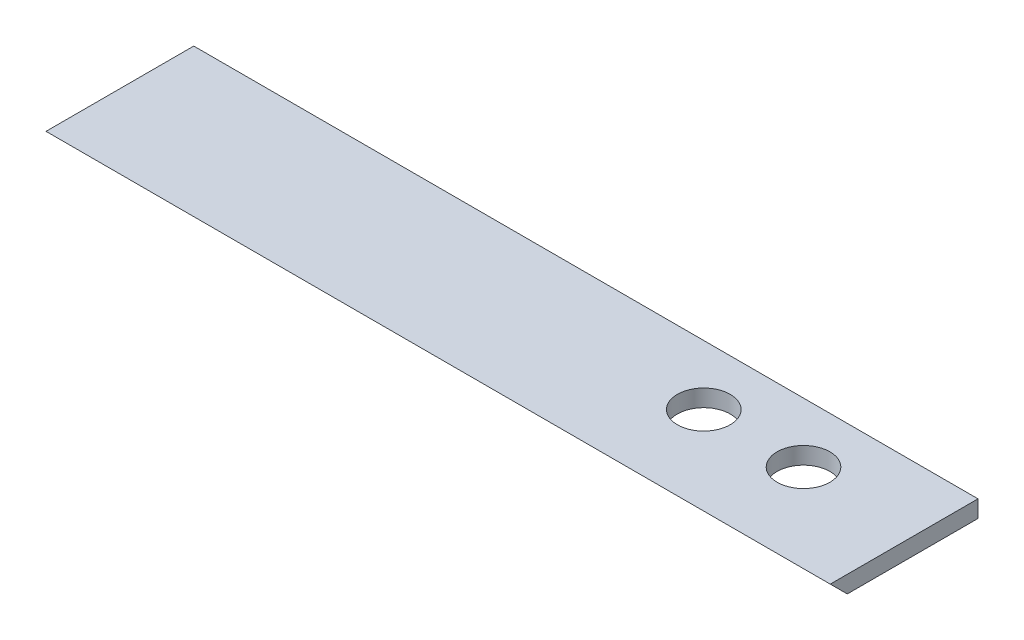
from build123d import *

# Parameters (mm, degrees)
SKETCH1_W           = 876.3
SKETCH1_H           = 165.1
BOSS_EXTRUDE1_DEPTH = 19.05
SKETCH3_R           = 29.499999928
CUT_EXTRUDE1_DEPTH  = 19.05
SKETCH2_R           = 29.499999928
CUT_EXTRUDE2_DEPTH  = 19.05
CUT_EXTRUDE3_DEPTH  = 914.4


with BuildPart() as part:
    # Sketch1 → Boss-Extrude1 (new body)
    with BuildSketch(Plane(origin=(0, 0, 0), x_dir=(1, 0, 0), z_dir=(0, 1, 0))):
        with Locations((375.34945696, 66.731818106)):
            Rectangle(SKETCH1_W, SKETCH1_H)
    extrude(amount=BOSS_EXTRUDE1_DEPTH)

    # Sketch3 → Cut-Extrude1 (cut)
    with BuildSketch(Plane(origin=(0, 19.05, 0), x_dir=(1, 0, 0), z_dir=(0, 1, 0))):
        with Locations(Location((573.905935058, 82.4588113, 0), (0, 0, 270))):
            Circle(SKETCH3_R)
    extrude(amount=-CUT_EXTRUDE1_DEPTH, mode=Mode.SUBTRACT)

    # Sketch2 → Cut-Extrude2 (cut)
    with BuildSketch(Plane(origin=(0, 19.05, 0), x_dir=(1, 0, 0), z_dir=(0, 1, 0))):
        with Locations(Location((685.24027425, 82.567946762, 0), (0, 0, 270))):
            Circle(SKETCH2_R)
    extrude(amount=-CUT_EXTRUDE2_DEPTH, mode=Mode.SUBTRACT)

    # Sketch4 → Cut-Extrude3 (cut)
    with BuildSketch(Plane.ZY.offset(62.80054304)):
        Polygon((-3.231818106, 0), (15.818181894, 19.05), (15.818181894, 0), align=None)
    extrude(amount=-CUT_EXTRUDE3_DEPTH, mode=Mode.SUBTRACT)


solid = part.part
